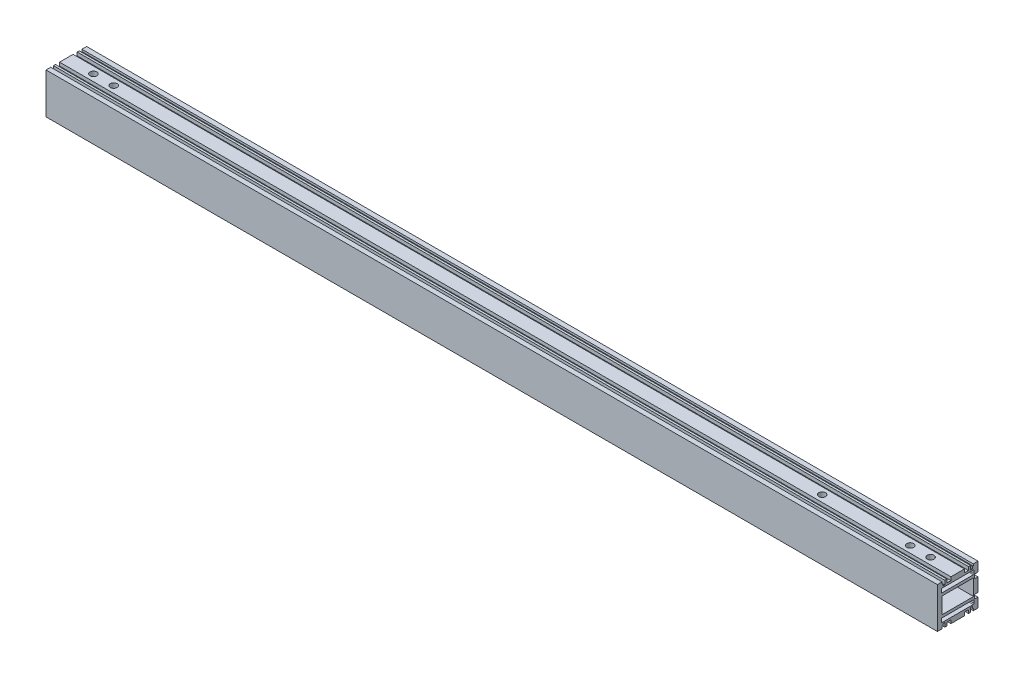
from build123d import *

# Parameters (mm, degrees)
SKETCH_1_W             = 23.5
SKETCH_1_H             = 12
EXTRUDE_1_DEPTH        = 329
HOLE_WIZARD_M6_1_D     = 5
HOLE_WIZARD_M6_1_DEPTH = 19
HOLE_WIZARD_M6_1_TIP   = 1.502151548
HOLE_WIZARD_M6_2_D     = 5
HOLE_WIZARD_M6_2_DEPTH = 19
HOLE_WIZARD_M6_2_TIP   = 1.502151548
HOLE_WIZARD_M6_3_D     = 5
HOLE_WIZARD_M6_3_DEPTH = 19
HOLE_WIZARD_M6_3_TIP   = 1.502151548


with BuildPart() as part:
    # 草图1 → 凸台-拉伸1 (new, symmetric)
    with BuildSketch(Plane(origin=(0, 0, 0), x_dir=(0, 0, -1), z_dir=(1, 0, 0))):
        Polygon((-15, 15), (-11.5, 15), (-11.5, 13.5), (-11, 13.5), (-11, 12), (-9.5, 12), (-9.5, 15), (-8, 15), (-8, 12.5), (-5, 12.5), (-5, 15), (5, 15), (5, 12.5), (8, 12.5), (8, 15), (9.5, 15), (9.5, 12), (11, 12), (11, 13.5), (11.5, 13.5), (11.5, 15), (15, 15), (15, 8), (12.5, 8), (12.5, 5), (15, 5), (15, -5), (12.5, -5), (12.5, -8), (15, -8), (15, -15), (11.5, -15), (11.5, -13.5), (11, -13.5), (11, -12), (9.5, -12), (9.5, -15), (8, -15), (8, -12.5), (5, -12.5), (5, -15), (-5, -15), (-5, -12.5), (-8, -12.5), (-8, -15), (-9.5, -15), (-9.5, -12), (-11, -12), (-11, -13.5), (-11.5, -13.5), (-11.5, -15), (-15, -15), align=None)
        with BuildLine():
            Line((12, -10.5), (12, -8.5))
            ThreePointArc((12, -8.5), (11.853553391, -8.146446609), (11.5, -8))
            Line((11.5, -8), (-11.5, -8))
            ThreePointArc((-11.5, -8), (-11.853553391, -8.146446609), (-12, -8.5))
            Line((-12, -8.5), (-12, -10.5))
            ThreePointArc((-12, -10.5), (-11.853553391, -10.853553391), (-11.5, -11))
            Line((-11.5, -11), (11.5, -11))
            ThreePointArc((11.5, -11), (11.853553391, -10.853553391), (12, -10.5))
        make_face(mode=Mode.SUBTRACT)
        with BuildLine():
            Line((-11.5, 11), (11.5, 11))
            ThreePointArc((11.5, 11), (11.853553391, 10.853553391), (12, 10.5))
            Line((12, 10.5), (12, 8.5))
            ThreePointArc((12, 8.5), (11.853553391, 8.146446609), (11.5, 8))
            Line((11.5, 8), (-11.5, 8))
            ThreePointArc((-11.5, 8), (-11.853553391, 8.146446609), (-12, 8.5))
            Line((-12, 8.5), (-12, 10.5))
            ThreePointArc((-12, 10.5), (-11.853553391, 10.853553391), (-11.5, 11))
        make_face(mode=Mode.SUBTRACT)
        Rectangle(SKETCH_1_W, SKETCH_1_H, mode=Mode.SUBTRACT)
    extrude(amount=EXTRUDE_1_DEPTH, both=True)

    # M6 螺纹孔1
    with Locations(Plane(origin=(0, 15, 0), x_dir=(1, 0, 0), z_dir=(0, 1, 0))):
        with Locations((-309, 0), (-294, 0), (294, 0), (309, 0), (229, 0)):
            Hole(HOLE_WIZARD_M6_1_D / 2, depth=HOLE_WIZARD_M6_1_DEPTH)
            with Locations((0, 0, -(HOLE_WIZARD_M6_1_DEPTH + HOLE_WIZARD_M6_1_TIP / 2))):  # 118° drill point
                Cone(0, HOLE_WIZARD_M6_1_D / 2, HOLE_WIZARD_M6_1_TIP, mode=Mode.SUBTRACT)

    # M6 螺纹孔2
    with Locations(Plane(origin=(0, -15, 0), x_dir=(-1, 0, 0), z_dir=(0, -1, 0))):
        with Locations((-309, 0), (-294, 0), (309, 0), (294, 0)):
            Hole(HOLE_WIZARD_M6_2_D / 2, depth=HOLE_WIZARD_M6_2_DEPTH)
            with Locations((0, 0, -(HOLE_WIZARD_M6_2_DEPTH + HOLE_WIZARD_M6_2_TIP / 2))):  # 118° drill point
                Cone(0, HOLE_WIZARD_M6_2_D / 2, HOLE_WIZARD_M6_2_TIP, mode=Mode.SUBTRACT)

    # M6 螺纹孔3
    with Locations(Plane(origin=(0, 0, -15), x_dir=(-1, 0, 0), z_dir=(0, 0, -1))):
        with Locations((194, 0), (89, 0), (29, 0), (-76, 0)):
            Hole(HOLE_WIZARD_M6_3_D / 2, depth=HOLE_WIZARD_M6_3_DEPTH)
            with Locations((0, 0, -(HOLE_WIZARD_M6_3_DEPTH + HOLE_WIZARD_M6_3_TIP / 2))):  # 118° drill point
                Cone(0, HOLE_WIZARD_M6_3_D / 2, HOLE_WIZARD_M6_3_TIP, mode=Mode.SUBTRACT)


solid = part.part
